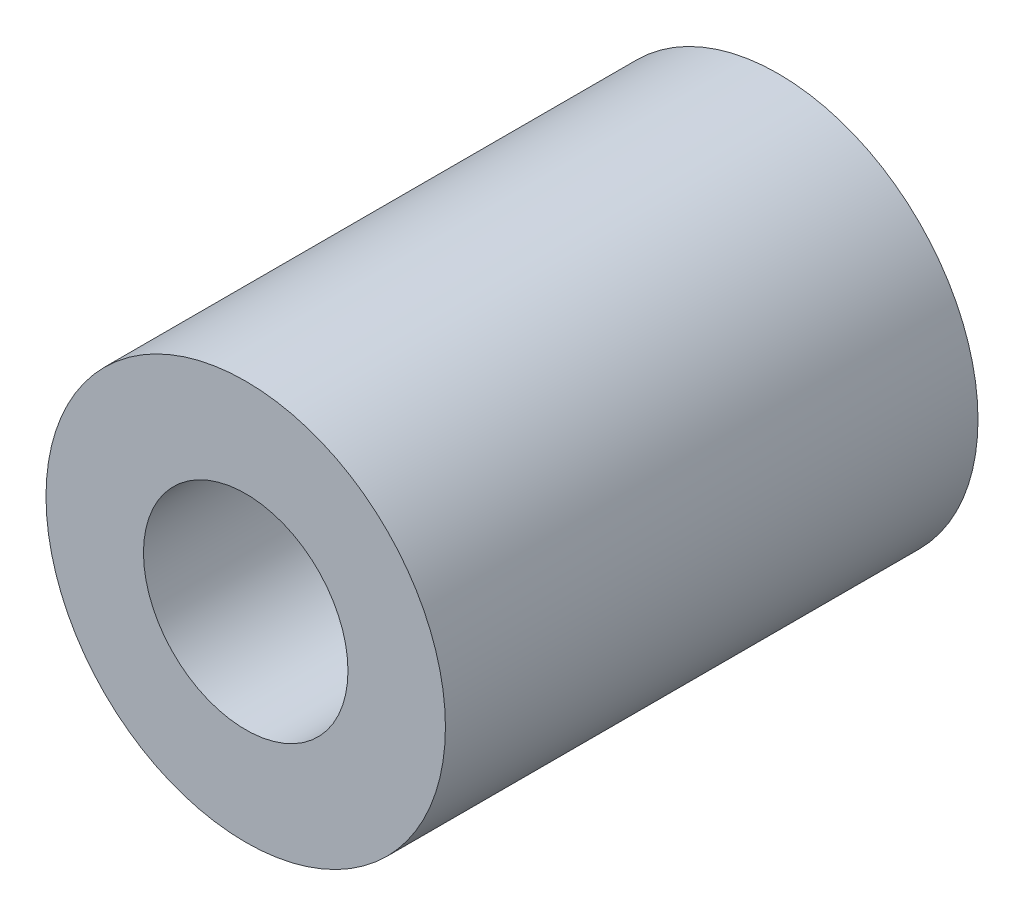
from build123d import *

# Parameters (mm, degrees)
SKETCH1_R      = 4.7625
SKETCH1_R_2    = 2.4384
EXTRUDE1_DEPTH = 6.35


with BuildPart() as part:
    # Sketch1 → Extrude1 (new, symmetric)
    with BuildSketch(Plane.XY):
        Circle(SKETCH1_R)
        Circle(SKETCH1_R_2, mode=Mode.SUBTRACT)
    extrude(amount=EXTRUDE1_DEPTH, both=True)


solid = part.part
